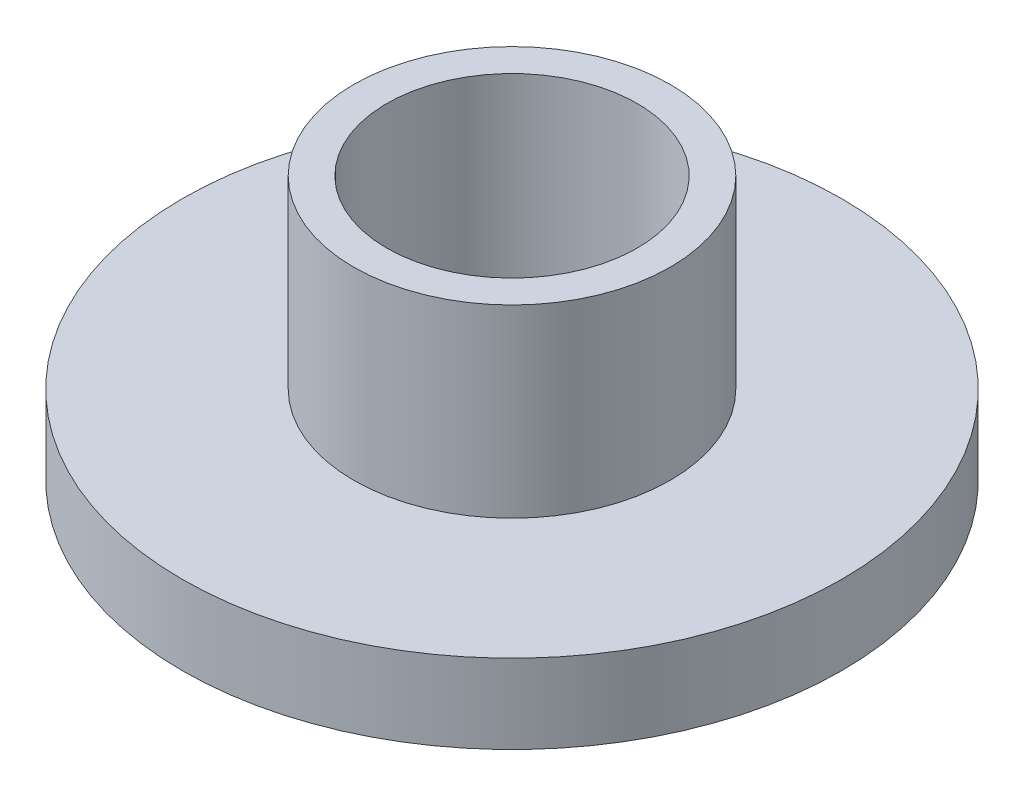
from build123d import *

# Parameters (mm, degrees)
SKETCH_1_R          = 5
EXTRUDE_1_DEPTH     = 4
SKETCH_2_R          = 1.9
CUT_EXTRUDE_1_DEPTH = 9.124038405
SKETCH_3_OUTSIDE_W  = 14.94
SKETCH_3_OUTSIDE_H  = 14.94
SKETCH_3_OUTSIDE_R  = 2.4
CUT_EXTRUDE_2_DEPTH = 2.8


with BuildPart() as part:
    # 草图1 → 拉伸1 (new body)
    with BuildSketch(Plane(origin=(0, 0, 0), x_dir=(1, 0, 0), z_dir=(0, 1, 0))):
        with Locations(Location((0, 0, 0), (0, 0, 270))):
            Circle(SKETCH_1_R)
    extrude(amount=EXTRUDE_1_DEPTH)

    # 草图2 → 切除-拉伸1 (cut, through all)
    with BuildSketch(Plane(origin=(0, 4, 0), x_dir=(-1, 0, 0), z_dir=(0, 1, 0))):
        with Locations(Location((0, 0, 0), (0, 0, 90))):
            Circle(SKETCH_2_R)
    extrude(amount=-CUT_EXTRUDE_1_DEPTH, mode=Mode.SUBTRACT)

    # 草图3 outside → 切除-拉伸2 (cut)
    with BuildSketch(Plane(origin=(0, 4, 0), x_dir=(1, 0, 0), z_dir=(0, 1, 0))):
        Rectangle(SKETCH_3_OUTSIDE_W, SKETCH_3_OUTSIDE_H)
        with Locations(Location((0, 0, 0), (0, 0, 270))):
            Circle(SKETCH_3_OUTSIDE_R, mode=Mode.SUBTRACT)
    extrude(amount=-CUT_EXTRUDE_2_DEPTH, mode=Mode.SUBTRACT)


solid = part.part
